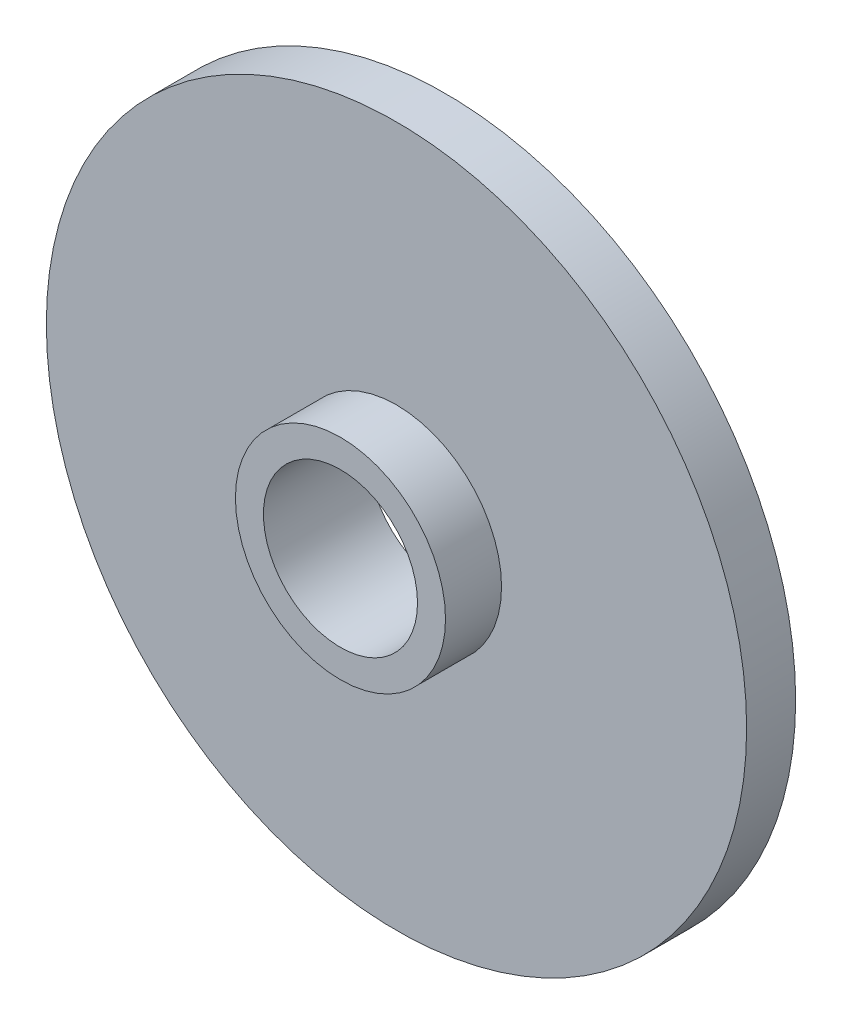
from build123d import *

# Parameters (mm, degrees)
SKETCH_1_R          = 50
EXTRUDE_1_DEPTH     = 7
SKETCH_2_R          = 15
EXTRUDE_2_DEPTH     = 8
SKETCH_3_R          = 11
CUT_EXTRUDE_1_DEPTH = 73.284161474


with BuildPart() as part:
    # ｽｹｯﾁ1 → ﾎﾞｽ - 押し出し1 (new body)
    with BuildSketch(Plane.XY):
        Circle(SKETCH_1_R)
    extrude(amount=EXTRUDE_1_DEPTH)

    # ｽｹｯﾁ2 → ﾎﾞｽ - 押し出し2 (add)
    with BuildSketch(Plane.XY.offset(7)):
        Circle(SKETCH_2_R)
    extrude(amount=EXTRUDE_2_DEPTH)

    # ｽｹｯﾁ3 → ｶｯﾄ - 押し出し1 (cut, through all)
    with BuildSketch(Plane.XY.offset(15)):
        Circle(SKETCH_3_R)
    extrude(amount=-CUT_EXTRUDE_1_DEPTH, mode=Mode.SUBTRACT)


solid = part.part
